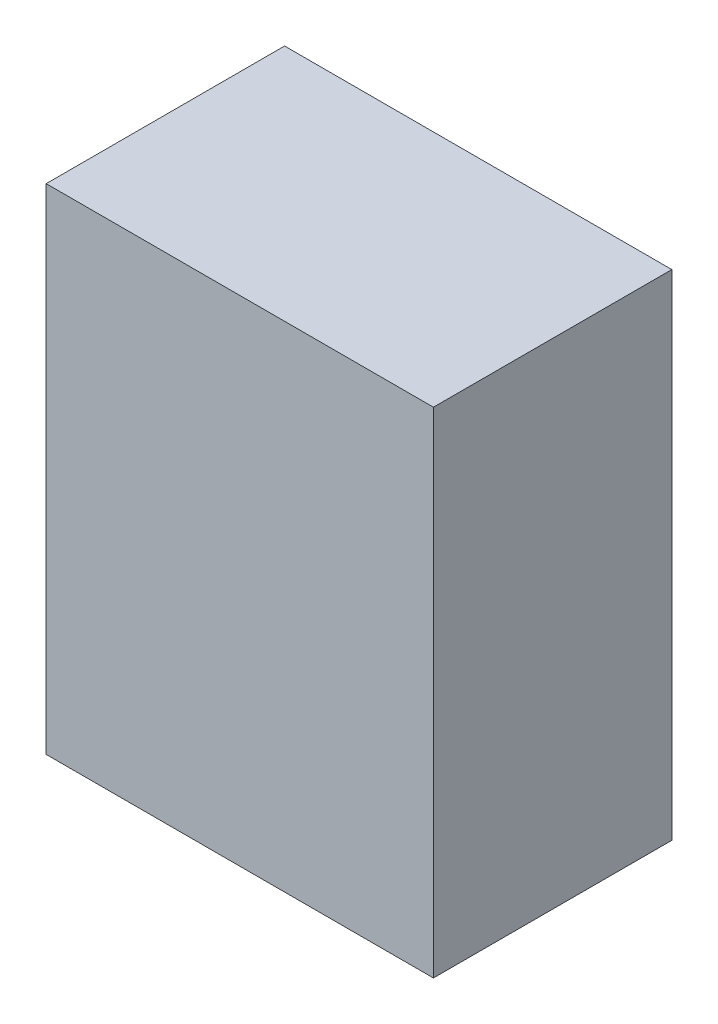
from build123d import *

# Parameters (mm, degrees)
SKETCH1_W           = 129.942193248
SKETCH1_H           = 165.882818936
BOSS_EXTRUDE1_DEPTH = 80


with BuildPart() as part:
    # Sketch1 → Boss-Extrude1 (new body)
    with BuildSketch(Plane.XY):
        with Locations((64.971096624, -82.941409468)):
            Rectangle(SKETCH1_W, SKETCH1_H)
    extrude(amount=BOSS_EXTRUDE1_DEPTH)


solid = part.part
